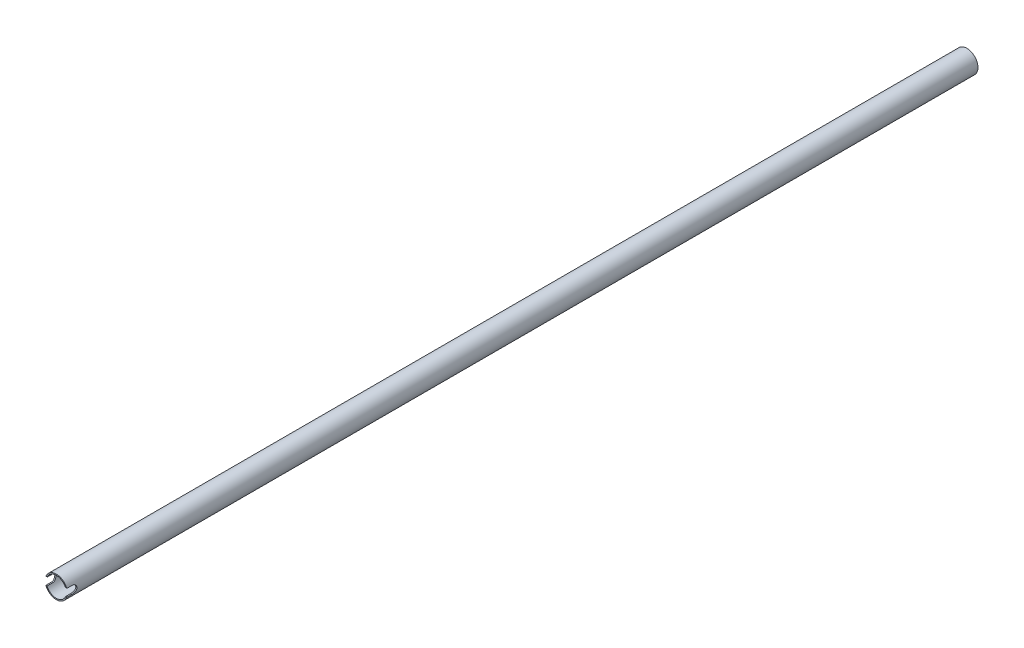
from build123d import *

# Parameters (mm, degrees)
SKETCH4_R           = 29
SKETCH4_R_2         = 26
BOSS_EXTRUDE1_DEPTH = 2380
CUT_EXTRUDE1_DEPTH  = 2381.883239472
FILLET1_R           = 1


with BuildPart() as part:
    # Sketch4 → Boss-Extrude1 (new body)
    with BuildSketch(Plane.XY):
        with Locations((29, 0)):
            Circle(SKETCH4_R)
        with Locations((29, 0)):
            Circle(SKETCH4_R_2, mode=Mode.SUBTRACT)
    extrude(amount=-BOSS_EXTRUDE1_DEPTH)

    # Sketch6 → Cut-Extrude1 (cut, through all)
    with BuildSketch(Plane(origin=(0, 0, 0), x_dir=(0, 0, -1), z_dir=(1, 0, 0))):
        with BuildLine():
            Line((0, 10), (0, -10))
            Line((0, -10), (15, -10))
            ThreePointArc((15, -10), (25, 0), (15, 10))
            Line((15, 10), (0, 10))
        make_face()
    extrude(amount=CUT_EXTRUDE1_DEPTH, mode=Mode.SUBTRACT)

    # Fillet1
    fillet1_edges = [part.edges().sort_by_distance(p)[0] for p in [
        (3.389342411, 10, 0),
        (54.610657589, 10, 0),
        (3.389342411, -10, 0),
        (54.610657589, -10, 0),
    ]]
    fillet(fillet1_edges, radius=FILLET1_R)


solid = part.part
